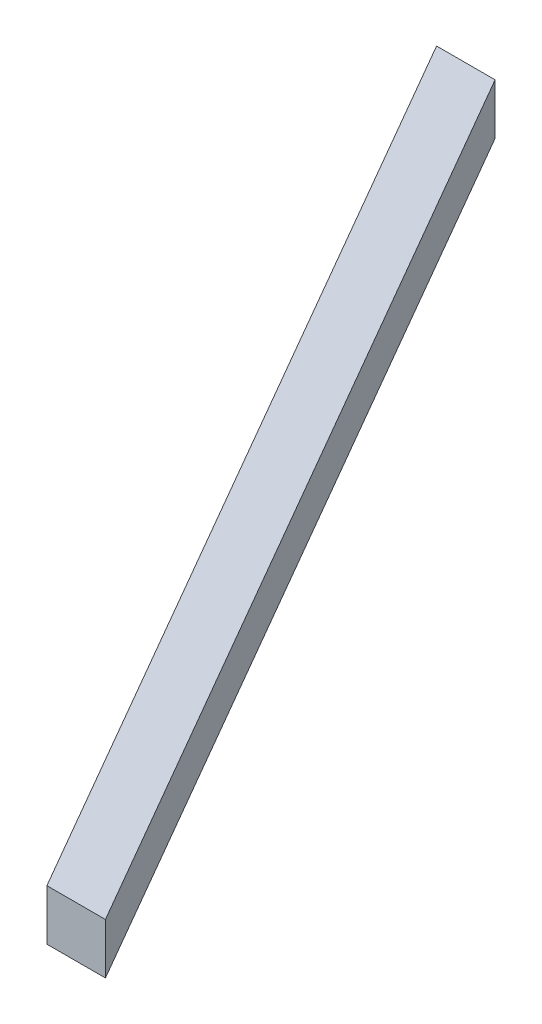
from build123d import *

# Parameters (mm, degrees)
EXTRUDE_1_DEPTH = 20


with BuildPart() as part:
    # 草图1 → 凸台-拉伸1 (new body)
    with BuildSketch(Plane(origin=(0, 0, 0), x_dir=(1, 0, 0), z_dir=(0, 1, 0))):
        Polygon((270, -200), (480, -563.730669589), (503.094010768, -563.730669589), (293.094010768, -200), align=None)
    extrude(amount=EXTRUDE_1_DEPTH)


solid = part.part
